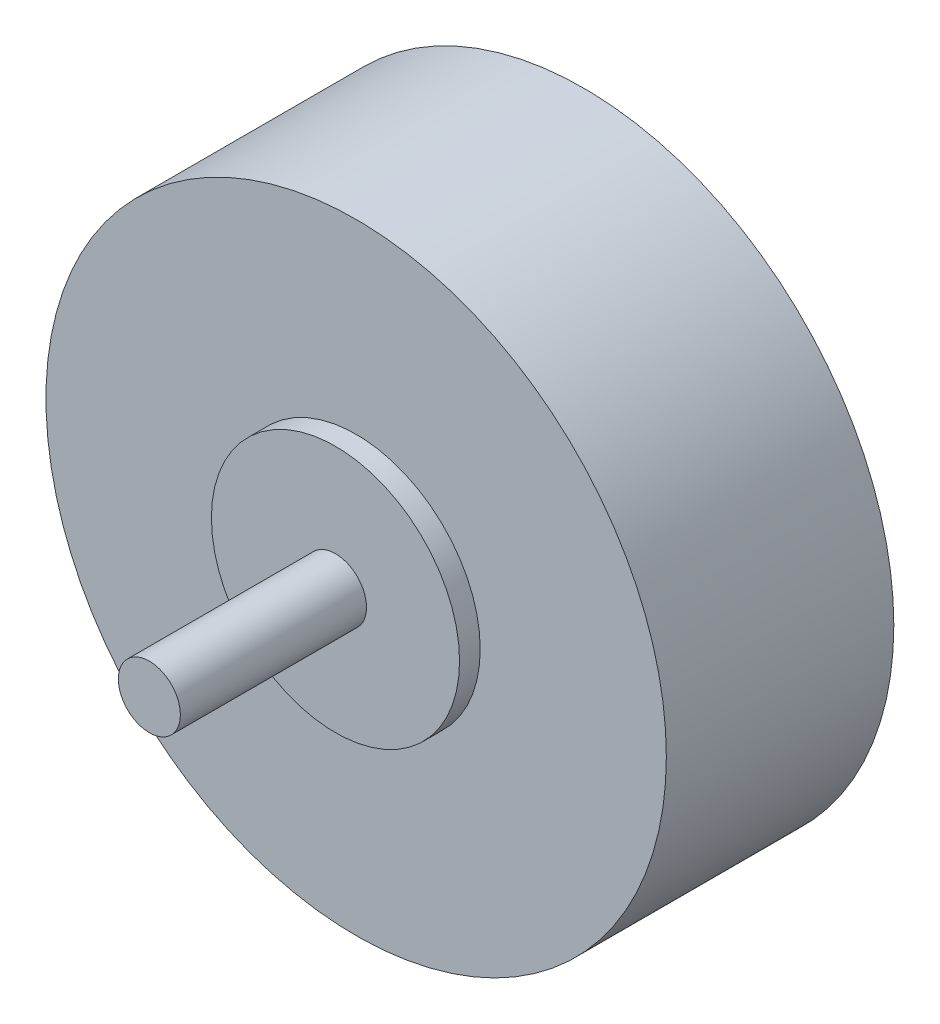
from build123d import *

# Parameters (mm, degrees)
ESQUISSE1_R        = 7.5
BOSS_EXTRU_1_DEPTH = 5.5
ESQUISSE2_R        = 3
BOSS_EXTRU_2_DEPTH = 0.5
ESQUISSE3_R        = 0.75
BOSS_EXTRU_3_DEPTH = 4.5
ESQUISSE4_R        = 2
BOSS_EXTRU_4_DEPTH = 1.4
BOSS_EXTRU_5_START = 4
ESQUISSE5_R        = 0.75
BOSS_EXTRU_5_DEPTH = 4


with BuildPart() as part:
    # Esquisse1 → Boss.-Extru.1 (new body)
    with BuildSketch(Plane.XY):
        Circle(ESQUISSE1_R)
    extrude(amount=BOSS_EXTRU_1_DEPTH)

    # Esquisse2 → Boss.-Extru.2 (add)
    with BuildSketch(Plane.XY.offset(5.5)):
        Circle(ESQUISSE2_R)
    extrude(amount=BOSS_EXTRU_2_DEPTH)

    # Esquisse3 → Boss.-Extru.3 (add)
    with BuildSketch(Plane.XY.offset(6)):
        Circle(ESQUISSE3_R)
    extrude(amount=BOSS_EXTRU_3_DEPTH)

    # Esquisse4 → Boss.-Extru.4 (add)
    with BuildSketch(Plane(origin=(0, 0, 0), x_dir=(-1, 0, 0), z_dir=(0, 0, -1))):
        with Locations(Location((0, 0, 0), (0, 0, 180))):
            Circle(ESQUISSE4_R)
    extrude(amount=BOSS_EXTRU_4_DEPTH)

    # Esquisse5 → Boss.-Extru.5 (add)
    with BuildSketch(Plane(origin=(0, 0, 0), x_dir=(-1, 0, 0), z_dir=(0, 0, -1)).offset(BOSS_EXTRU_5_START)):
        with Locations(Location((0, 0, 0), (0, 0, 180))):
            Circle(ESQUISSE5_R)
    extrude(amount=-BOSS_EXTRU_5_DEPTH)


solid = part.part
